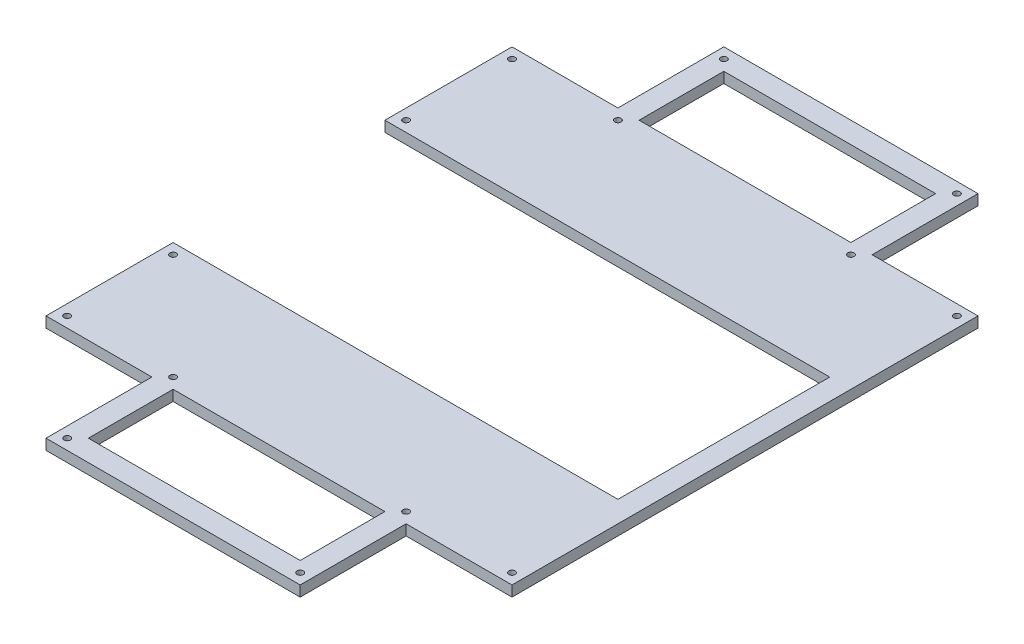
from build123d import *

# Parameters (mm, degrees)
ESQUISSE1_R        = 1.5
ESQUISSE1_W        = 100
ESQUISSE1_H        = 40
BOSS_EXTRU_1_DEPTH = 5


with BuildPart() as part:
    # Esquisse1 → Boss.-Extru.1 (new body)
    with BuildSketch(Plane(origin=(0, 0, 0), x_dir=(1, 0, 0), z_dir=(0, 1, 0))):
        Polygon((-60, 110), (-60, 160), (60, 160), (60, 110), (110, 110), (110, -110), (60, -110), (60, -160), (-60, -160), (-60, -110), (-110, -110), (-110, -50), (100, -50), (100, 50), (-110, 50), (-110, 110), align=None)
        with Locations(Location((-105, -105, 0), (0, 0, 270))):
            Circle(ESQUISSE1_R, mode=Mode.SUBTRACT)
        with Locations(Location((-105, -55, 0), (0, 0, 270))):
            Circle(ESQUISSE1_R, mode=Mode.SUBTRACT)
        with Locations(Location((-55, -105, 0), (0, 0, 270))):
            Circle(ESQUISSE1_R, mode=Mode.SUBTRACT)
        with Locations(Location((-55, -155, 0), (0, 0, 270))):
            Circle(ESQUISSE1_R, mode=Mode.SUBTRACT)
        with Locations(Location((-55, 155, 0), (0, 0, 90))):
            Circle(ESQUISSE1_R, mode=Mode.SUBTRACT)
        with Locations(Location((-55, 105, 0), (0, 0, 90))):
            Circle(ESQUISSE1_R, mode=Mode.SUBTRACT)
        with Locations(Location((-105, 105, 0), (0, 0, 90))):
            Circle(ESQUISSE1_R, mode=Mode.SUBTRACT)
        with Locations(Location((-105, 55, 0), (0, 0, 90))):
            Circle(ESQUISSE1_R, mode=Mode.SUBTRACT)
        with Locations(Location((55, -155, 0), (0, 0, 90))):
            Circle(ESQUISSE1_R, mode=Mode.SUBTRACT)
        with Locations(Location((55, -105, 0), (0, 0, 90))):
            Circle(ESQUISSE1_R, mode=Mode.SUBTRACT)
        with Locations(Location((105, -105, 0), (0, 0, 90))):
            Circle(ESQUISSE1_R, mode=Mode.SUBTRACT)
        with Locations(Location((105, 105, 0), (0, 0, 270))):
            Circle(ESQUISSE1_R, mode=Mode.SUBTRACT)
        with Locations(Location((55, 105, 0), (0, 0, 270))):
            Circle(ESQUISSE1_R, mode=Mode.SUBTRACT)
        with Locations(Location((55, 155, 0), (0, 0, 270))):
            Circle(ESQUISSE1_R, mode=Mode.SUBTRACT)
        with Locations((0, -130)):
            Rectangle(ESQUISSE1_W, ESQUISSE1_H, mode=Mode.SUBTRACT)
        with Locations((0, 130)):
            Rectangle(ESQUISSE1_W, ESQUISSE1_H, mode=Mode.SUBTRACT)
    extrude(amount=BOSS_EXTRU_1_DEPTH)


solid = part.part
